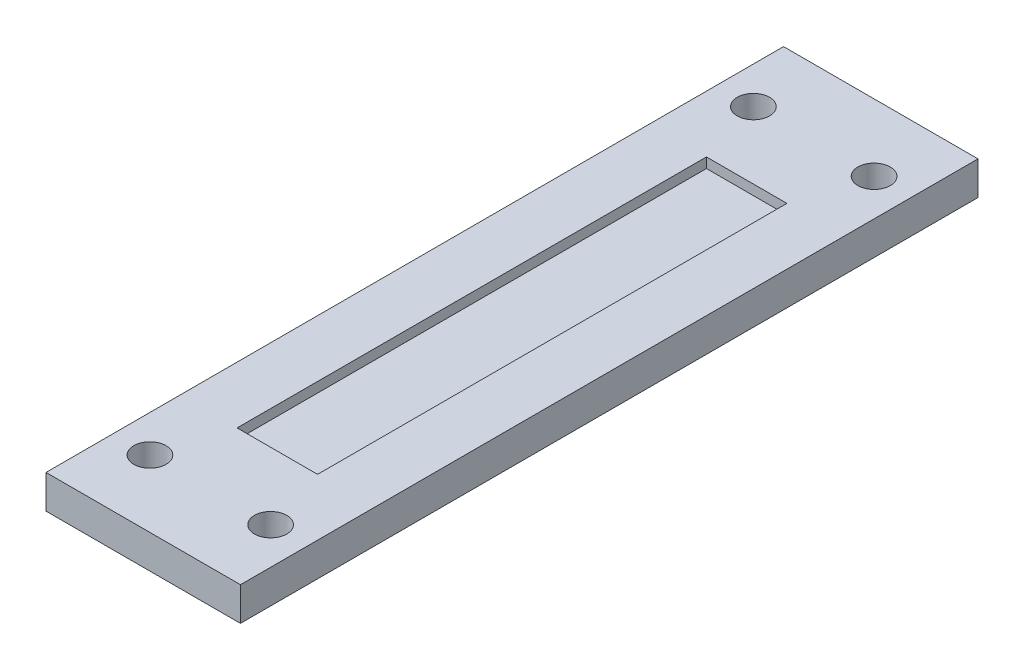
from build123d import *

# Parameters (mm, degrees)
SKETCH1_W           = 29
SKETCH1_H           = 110
BOSS_EXTRUDE1_DEPTH = 5
SKETCH2_R           = 2.413
CUT_EXTRUDE5_DEPTH  = 58.098598932
SKETCH3_W           = 12
SKETCH3_H           = 70
CUT_EXTRUDE6_DEPTH  = 1.5


with BuildPart() as part:
    # Sketch1 → Boss-Extrude1 (new body)
    with BuildSketch(Plane(origin=(0, 0, 0), x_dir=(1, 0, 0), z_dir=(0, 1, 0))):
        Rectangle(SKETCH1_W, SKETCH1_H)
    extrude(amount=BOSS_EXTRUDE1_DEPTH)

    # Sketch2 → Cut-Extrude5 (cut, through all)
    with BuildSketch(Plane(origin=(0, 5, 0), x_dir=(1, 0, 0), z_dir=(0, 1, 0))):
        with Locations(Location((-9, 45, 0), (0, 0, 270))):
            Circle(SKETCH2_R)
        with Locations(Location((9, 45, 0), (0, 0, 270))):
            Circle(SKETCH2_R)
        with Locations(Location((9, -45, 0), (0, 0, 270))):
            Circle(SKETCH2_R)
        with Locations(Location((-9, -45, 0), (0, 0, 270))):
            Circle(SKETCH2_R)
    extrude(amount=-CUT_EXTRUDE5_DEPTH, mode=Mode.SUBTRACT)

    # Sketch3 → Cut-Extrude6 (cut)
    with BuildSketch(Plane(origin=(0, 5, 0), x_dir=(1, 0, 0), z_dir=(0, 1, 0))):
        Rectangle(SKETCH3_W, SKETCH3_H)
    extrude(amount=-CUT_EXTRUDE6_DEPTH, mode=Mode.SUBTRACT)


solid = part.part
